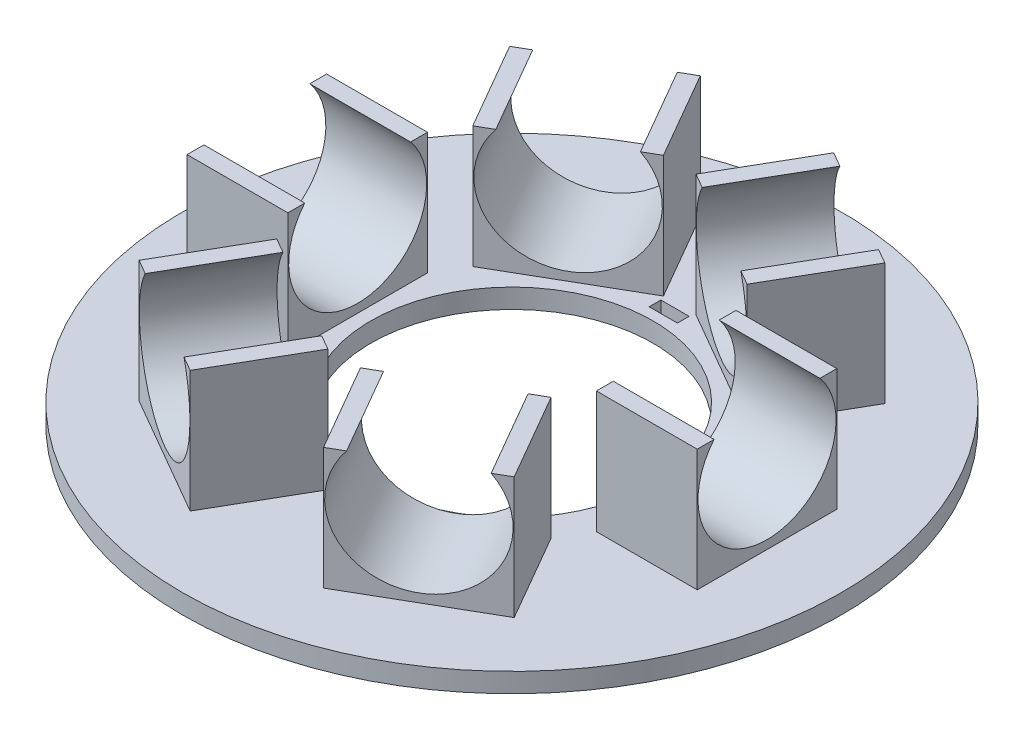
from build123d import *

# Parameters (mm, degrees)
SKETCH1_R           = 42.5
BOSS_EXTRUDE1_DEPTH = 2.5
SKETCH3_W           = 13
SKETCH3_H           = 18
BOSS_EXTRUDE2_DEPTH = 20
SKETCH4_R           = 8.9
CUT_EXTRUDE2_DEPTH  = 20
SKETCH5_R           = 8.9
CUT_EXTRUDE3_DEPTH  = 20
SKETCH6_R           = 8.9
CUT_EXTRUDE4_DEPTH  = 20
CUT_EXTRUDE5_START  = -20
SKETCH7_R           = 8.9
CUT_EXTRUDE5_DEPTH  = 20
CUT_EXTRUDE6_START  = -20
SKETCH8_R           = 8.9
CUT_EXTRUDE6_DEPTH  = 20
CUT_EXTRUDE7_START  = -20
SKETCH9_R           = 8.9
CUT_EXTRUDE7_DEPTH  = 20
CUT_EXTRUDE8_DEPTH  = 76.388
SKETCH11_W          = 18
SKETCH11_H          = 4.285356177
CUT_EXTRUDE9_DEPTH  = 76.388
SKETCH12_R          = 18.204170311
CUT_EXTRUDE10_DEPTH = 76.388
SKETCH16_W          = 3.647311836
SKETCH16_H          = 1.511893876
CUT_EXTRUDE13_DEPTH = 101.6


with BuildPart() as part:
    # Sketch1 → Boss-Extrude1 (new body)
    with BuildSketch(Plane(origin=(0, 0, 0), x_dir=(1, 0, 0), z_dir=(0, 1, 0))):
        Circle(SKETCH1_R)
    extrude(amount=BOSS_EXTRUDE1_DEPTH)

    # Sketch3 → Boss-Extrude2 (add)
    with BuildSketch(Plane(origin=(0, 2.5, 0), x_dir=(1, 0, 0), z_dir=(0, 1, 0))):
        with Locations((-26.394376419, 0)):
            Rectangle(SKETCH3_W, SKETCH3_H)
        with Locations((26.394376419, 0)):
            Rectangle(SKETCH3_W, SKETCH3_H)
        Polygon((-8.599367677, 32.894541729), (-2.099367677, 21.63621148), (-17.687824945, 12.63621148), (-24.187824945, 23.894541729), align=None)
        Polygon((8.599367677, 32.894541729), (24.187824945, 23.894541729), (17.687824945, 12.63621148), (2.099367677, 21.63621148), align=None)
        Polygon((8.599367677, -32.894541729), (2.099367677, -21.63621148), (17.687824945, -12.63621148), (24.187824945, -23.894541729), align=None)
        Polygon((-8.599367677, -32.894541729), (-24.187824945, -23.894541729), (-17.687824945, -12.63621148), (-2.099367677, -21.63621148), align=None)
    extrude(amount=BOSS_EXTRUDE2_DEPTH)

    # Sketch4 → Cut-Extrude2 (cut)
    with BuildSketch(Plane.ZY.offset(32.894376419)):
        with Locations((0, 12.5)):
            Circle(SKETCH4_R)
    extrude(amount=-CUT_EXTRUDE2_DEPTH, mode=Mode.SUBTRACT)

    # Sketch5 → Cut-Extrude3 (cut)
    with BuildSketch(Plane(origin=(-16.393596311, 0, 28.394541729), x_dir=(0.8660254037844386, 0, 0.5000000000000003), z_dir=(-0.5000000000000003, 0, 0.8660254037844386))):
        with Locations((0, 12.5)):
            Circle(SKETCH5_R)
    extrude(amount=-CUT_EXTRUDE3_DEPTH, mode=Mode.SUBTRACT)

    # Sketch6 → Cut-Extrude4 (cut)
    with BuildSketch(Plane(origin=(16.393596311, 0, 28.394541729), x_dir=(0.8660254037844386, 0, -0.5000000000000003), z_dir=(0.5000000000000003, 0, 0.8660254037844386))):
        with Locations((0, 12.5)):
            Circle(SKETCH6_R)
    extrude(amount=-CUT_EXTRUDE4_DEPTH, mode=Mode.SUBTRACT)

    # Sketch7 → Cut-Extrude5 (cut)
    with BuildSketch(Plane(origin=(32.894376419, 0, 0), x_dir=(0, 0, -1), z_dir=(1, 0, 0)).offset(CUT_EXTRUDE5_START)):
        with Locations((0, 12.5)):
            Circle(SKETCH7_R)
    extrude(amount=CUT_EXTRUDE5_DEPTH, mode=Mode.SUBTRACT)

    # Sketch8 → Cut-Extrude6 (cut)
    with BuildSketch(Plane(origin=(16.393596311, 0, -28.394541729), x_dir=(-0.8660254037844386, 0, -0.5000000000000003), z_dir=(0.5000000000000003, 0, -0.8660254037844386)).offset(CUT_EXTRUDE6_START)):
        with Locations((0, 12.5)):
            Circle(SKETCH8_R)
    extrude(amount=CUT_EXTRUDE6_DEPTH, mode=Mode.SUBTRACT)

    # Sketch9 → Cut-Extrude7 (cut)
    with BuildSketch(Plane(origin=(-16.393596311, 0, -28.394541729), x_dir=(-0.8660254037844386, 0, 0.5000000000000003), z_dir=(-0.5000000000000003, 0, -0.8660254037844386)).offset(CUT_EXTRUDE7_START)):
        with Locations((0, 12.5)):
            Circle(SKETCH9_R)
    extrude(amount=CUT_EXTRUDE7_DEPTH, mode=Mode.SUBTRACT)

    # Sketch10 → Cut-Extrude8 (cut)
    with BuildSketch(Plane(origin=(-16.393596311, 0, -28.394541729), x_dir=(-0.8660254037844386, 0, 0.5000000000000003), z_dir=(-0.5000000000000003, 0, -0.8660254037844386))):
        Polygon((-35.669118209, 18.214643823), (-9, 18.214643823), (-9, 22.5), (9, 22.5), (9, 18.214643823), (33.747549551, 18.214643823), (33.747549551, 25.559573076), (-35.669118209, 25.559573076), align=None)
    extrude(amount=-CUT_EXTRUDE8_DEPTH, mode=Mode.SUBTRACT)

    # Sketch11 → Cut-Extrude9 (cut)
    with BuildSketch(Plane(origin=(-16.393596311, 0, -28.394541729), x_dir=(-0.8660254037844386, 0, 0.5000000000000003), z_dir=(-0.5000000000000003, 0, -0.8660254037844386))):
        with Locations((0, 20.357321912)):
            Rectangle(SKETCH11_W, SKETCH11_H)
    extrude(amount=-CUT_EXTRUDE9_DEPTH, mode=Mode.SUBTRACT)

    # Sketch12 → Cut-Extrude10 (cut)
    with BuildSketch(Plane(origin=(0, 2.5, 0), x_dir=(1, 0, 0), z_dir=(0, 1, 0))):
        Circle(SKETCH12_R)
    extrude(amount=-CUT_EXTRUDE10_DEPTH, mode=Mode.SUBTRACT)

    # Sketch16 → Cut-Extrude13 (cut)
    with BuildSketch(Plane(origin=(0, 2.5, 0), x_dir=(1, 0, 0), z_dir=(0, 1, 0))):
        with Locations((0, -20.271174186)):
            Rectangle(SKETCH16_W, SKETCH16_H)
        with Locations((0, 20.271174186)):
            Rectangle(SKETCH16_W, SKETCH16_H)
    extrude(amount=-CUT_EXTRUDE13_DEPTH, mode=Mode.SUBTRACT)


solid = part.part
